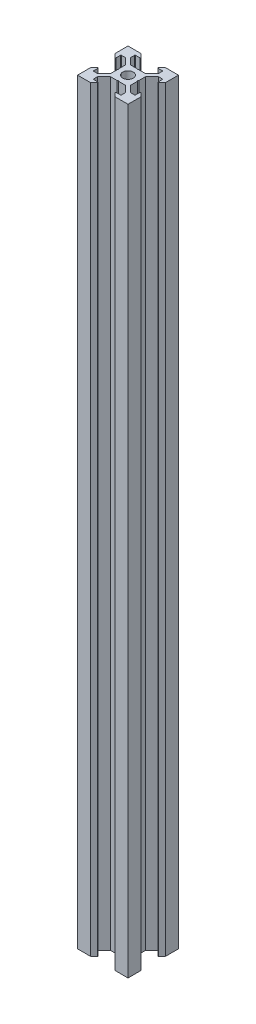
from build123d import *

# Parameters (mm, degrees)
BOSS_EXTRU_1_DEPTH      = 10
BOSS_EXTRU_1_DEPTH_BACK = 10
ESQUISSE1_W             = 20
ESQUISSE1_H             = 300
ESQUISSE2_R             = 2.1
ENL_V_MAT_EXTRU_1_DEPTH = 301.333148354


with BuildPart() as part:
    # Esquisse1 → Boss.-Extru.1 (new, two sides: drawn at the far end of the back side and taken through both)
    with BuildSketch(Plane.XY.offset(-BOSS_EXTRU_1_DEPTH_BACK)):
        Rectangle(ESQUISSE1_W, ESQUISSE1_H)
    extrude(amount=BOSS_EXTRU_1_DEPTH + BOSS_EXTRU_1_DEPTH_BACK)

    # Esquisse2 → Enlèv. mat.-Extru.1 (cut, through all)
    with BuildSketch(Plane(origin=(0, 150, 0), x_dir=(1, 0, 0), z_dir=(0, 1, 0))):
        with BuildLine():
            Line((-3.441421356, -8.641421356), (-4.8, -10))
            Line((-4.8, -10), (4.8, -10))
            Line((4.8, -10), (3.441421356, -8.641421356))
            ThreePointArc((3.441421356, -8.641421356), (3.398066806, -8.423463314), (3.582842712, -8.3))
            Line((3.582842712, -8.3), (5.3, -8.3))
            ThreePointArc((5.3, -8.3), (5.441421356, -8.241421356), (5.5, -8.1))
            Line((5.5, -8.1), (5.5, -6.560660172))
            Line((5.5, -6.560660172), (2.939339828, -4))
            Line((2.939339828, -4), (0.282842712, -4))
            Line((0.282842712, -4), (0, -3.717157288))
            Line((0, -3.717157288), (-0.282842712, -4))
            Line((-0.282842712, -4), (-2.939339828, -4))
            Line((-2.939339828, -4), (-5.5, -6.560660172))
            Line((-5.5, -6.560660172), (-5.5, -8.1))
            ThreePointArc((-5.5, -8.1), (-5.441421356, -8.241421356), (-5.3, -8.3))
            Line((-5.3, -8.3), (-3.582842712, -8.3))
            ThreePointArc((-3.582842712, -8.3), (-3.398066806, -8.423463314), (-3.441421356, -8.641421356))
        make_face()
        with BuildLine():
            Line((-10, 4.8), (-10, -4.8))
            Line((-10, -4.8), (-8.641421356, -3.441421356))
            ThreePointArc((-8.641421356, -3.441421356), (-8.423463314, -3.398066806), (-8.3, -3.582842712))
            Line((-8.3, -3.582842712), (-8.3, -5.3))
            ThreePointArc((-8.3, -5.3), (-8.241421356, -5.441421356), (-8.1, -5.5))
            Line((-8.1, -5.5), (-6.560660172, -5.5))
            Line((-6.560660172, -5.5), (-4, -2.939339828))
            Line((-4, -2.939339828), (-4, -0.282842712))
            Line((-4, -0.282842712), (-3.717157288, 0))
            Line((-3.717157288, 0), (-4, 0.282842712))
            Line((-4, 0.282842712), (-4, 2.939339828))
            Line((-4, 2.939339828), (-6.560660172, 5.5))
            Line((-6.560660172, 5.5), (-8.1, 5.5))
            ThreePointArc((-8.1, 5.5), (-8.241421356, 5.441421356), (-8.3, 5.3))
            Line((-8.3, 5.3), (-8.3, 3.582842712))
            ThreePointArc((-8.3, 3.582842712), (-8.423463314, 3.398066806), (-8.641421356, 3.441421356))
            Line((-8.641421356, 3.441421356), (-10, 4.8))
        make_face()
        with BuildLine():
            Line((8.641421356, -3.441421356), (10, -4.8))
            Line((10, -4.8), (10, 4.8))
            Line((10, 4.8), (8.641421356, 3.441421356))
            ThreePointArc((8.641421356, 3.441421356), (8.423463314, 3.398066806), (8.3, 3.582842712))
            Line((8.3, 3.582842712), (8.3, 5.3))
            ThreePointArc((8.3, 5.3), (8.241421356, 5.441421356), (8.1, 5.5))
            Line((8.1, 5.5), (6.560660172, 5.5))
            Line((6.560660172, 5.5), (4, 2.939339828))
            Line((4, 2.939339828), (4, 0.282842712))
            Line((4, 0.282842712), (3.717157288, 0))
            Line((3.717157288, 0), (4, -0.282842712))
            Line((4, -0.282842712), (4, -2.939339828))
            Line((4, -2.939339828), (6.560660172, -5.5))
            Line((6.560660172, -5.5), (8.1, -5.5))
            ThreePointArc((8.1, -5.5), (8.241421356, -5.441421356), (8.3, -5.3))
            Line((8.3, -5.3), (8.3, -3.582842712))
            ThreePointArc((8.3, -3.582842712), (8.423463314, -3.398066806), (8.641421356, -3.441421356))
        make_face()
        with BuildLine():
            Line((4.8, 10), (-4.8, 10))
            Line((-4.8, 10), (-3.441421356, 8.641421356))
            ThreePointArc((-3.441421356, 8.641421356), (-3.398066806, 8.423463314), (-3.582842712, 8.3))
            Line((-3.582842712, 8.3), (-5.3, 8.3))
            ThreePointArc((-5.3, 8.3), (-5.441421356, 8.241421356), (-5.5, 8.1))
            Line((-5.5, 8.1), (-5.5, 6.560660172))
            Line((-5.5, 6.560660172), (-2.939339828, 4))
            Line((-2.939339828, 4), (-0.282842712, 4))
            Line((-0.282842712, 4), (0, 3.717157288))
            Line((0, 3.717157288), (0.282842712, 4))
            Line((0.282842712, 4), (2.939339828, 4))
            Line((2.939339828, 4), (5.5, 6.560660172))
            Line((5.5, 6.560660172), (5.5, 8.1))
            ThreePointArc((5.5, 8.1), (5.441421356, 8.241421356), (5.3, 8.3))
            Line((5.3, 8.3), (3.582842712, 8.3))
            ThreePointArc((3.582842712, 8.3), (3.398066806, 8.423463314), (3.441421356, 8.641421356))
            Line((3.441421356, 8.641421356), (4.8, 10))
        make_face()
        Circle(ESQUISSE2_R)
    extrude(amount=-ENL_V_MAT_EXTRU_1_DEPTH, mode=Mode.SUBTRACT)


solid = part.part
